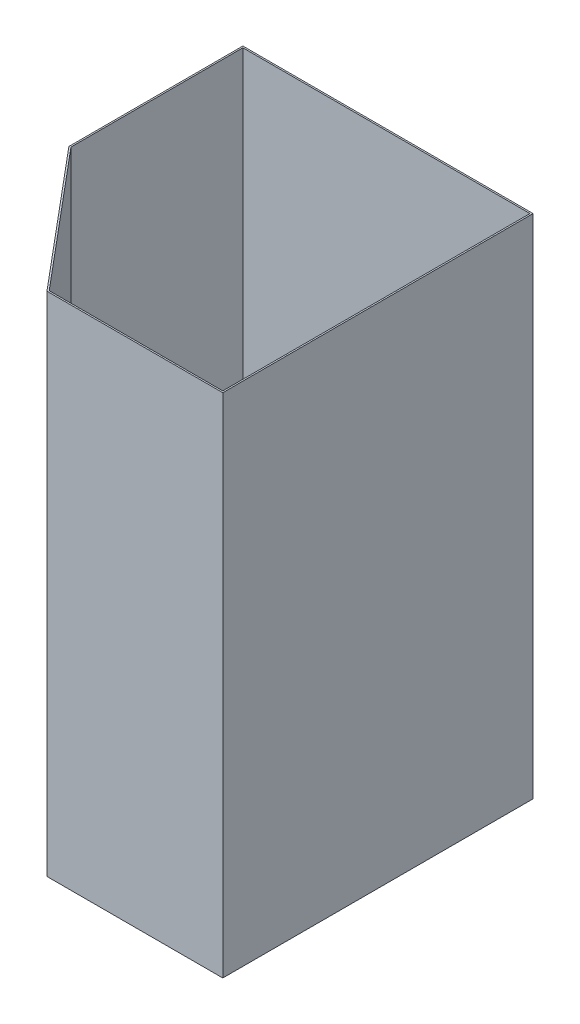
from build123d import *

# Parameters (mm, degrees)
EXTRUDE_1_DEPTH = 330


with BuildPart() as part:
    # Эскиз1 → Вытянуть-Тонкостенный1 (new body)
    with BuildSketch(Plane(origin=(0, 0, 0), x_dir=(1, 0, 0), z_dir=(0, 1, 0))):
        Polygon((1, -1), (-113.466307658, -1), (-187.920575114, 87.731140724), (-187.920575114, 201), (1, 201), align=None)
        Polygon((0, 0), (-113, 0), (-186.920575114, 88.095110959), (-186.920575114, 200), (0, 200), align=None, mode=Mode.SUBTRACT)
    extrude(amount=EXTRUDE_1_DEPTH)


solid = part.part
